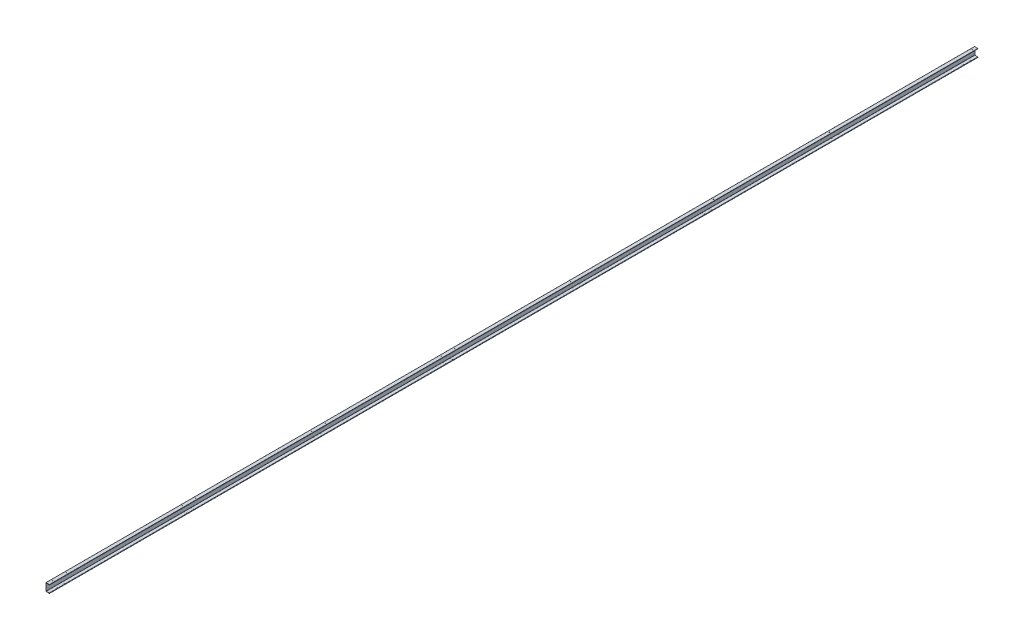
from build123d import *

# Parameters (mm, degrees)
BOSS_EXTRUDE1_DEPTH = 12000
FILLET1_R           = 3
FILLET2_R           = 1
FILLET3_R           = 1
CUT_EXTRUDE2_REACH  = 12002.501
SKETCH2_R           = 3
SKETCH5_R           = 3
CUT_EXTRUDE4_DEPTH  = 10


with BuildPart() as part:
    # Sketch1 → Boss-Extrude1 (new body)
    with BuildSketch(Plane.XY):
        Polygon((0, 50), (0, -50), (45, -50), (45, -44.9), (3, -44.9), (3, 44.9), (45, 44.9), (45, 50), align=None)
    extrude(amount=BOSS_EXTRUDE1_DEPTH)

    # Fillet1
    fillet1_edges = [part.edges().sort_by_distance(p)[0] for p in [
        (45, -44.9, 6000),
        (45, 44.9, 6000),
    ]]
    fillet(fillet1_edges, radius=FILLET1_R)

    # Fillet2
    fillet2_edges = [part.edges().sort_by_distance(p)[0] for p in [
        (45, -50, 6000),
        (0, -50, 6000),
        (0, 50, 6000),
        (45, 50, 6000),
    ]]
    fillet(fillet2_edges, radius=FILLET2_R)

    # Fillet3
    fillet3_edges = [part.edges().sort_by_distance(p)[0] for p in [
        (3, -44.9, 6000),
        (3, 44.9, 6000),
    ]]
    fillet(fillet3_edges, radius=FILLET3_R)

    # Sketch2 → Cut-Extrude2 (cut, up to next)
    with BuildSketch(Plane(origin=(0, 50, 0), x_dir=(1, 0, 0), z_dir=(0, 1, 0)), mode=Mode.PRIVATE) as cut_extrude2_sk1:
        with Locations(Location((22.5, -50, 0), (0, 0, 270))):
            Circle(SKETCH2_R)
    cut_extrude2_tool1 = extrude(cut_extrude2_sk1.sketch, amount=-CUT_EXTRUDE2_REACH, mode=Mode.PRIVATE) & part.part
    # Sketch2 → Cut-Extrude2 (cut, up to next)
    with BuildSketch(Plane(origin=(0, 50, 0), x_dir=(1, 0, 0), z_dir=(0, 1, 0)), mode=Mode.PRIVATE) as cut_extrude2_sk2:
        with Locations(Location((22.5, -223, 0), (0, 0, 270))):
            Circle(SKETCH2_R)
    cut_extrude2_tool2 = extrude(cut_extrude2_sk2.sketch, amount=-CUT_EXTRUDE2_REACH, mode=Mode.PRIVATE) & part.part
    # Sketch2 → Cut-Extrude2 (cut, up to next)
    with BuildSketch(Plane(origin=(0, 50, 0), x_dir=(1, 0, 0), z_dir=(0, 1, 0)), mode=Mode.PRIVATE) as cut_extrude2_sk3:
        with Locations(Location((22.5, -1723, 0), (0, 0, 270))):
            Circle(SKETCH2_R)
    cut_extrude2_tool3 = extrude(cut_extrude2_sk3.sketch, amount=-CUT_EXTRUDE2_REACH, mode=Mode.PRIVATE) & part.part
    # Sketch2 → Cut-Extrude2 (cut, up to next)
    with BuildSketch(Plane(origin=(0, 50, 0), x_dir=(1, 0, 0), z_dir=(0, 1, 0)), mode=Mode.PRIVATE) as cut_extrude2_sk4:
        with Locations(Location((22.5, -1896, 0), (0, 0, 270))):
            Circle(SKETCH2_R)
    cut_extrude2_tool4 = extrude(cut_extrude2_sk4.sketch, amount=-CUT_EXTRUDE2_REACH, mode=Mode.PRIVATE) & part.part
    # Sketch2 → Cut-Extrude2 (cut, up to next)
    with BuildSketch(Plane(origin=(0, 50, 0), x_dir=(1, 0, 0), z_dir=(0, 1, 0)), mode=Mode.PRIVATE) as cut_extrude2_sk5:
        with Locations(Location((22.5, -3396, 0), (0, 0, 270))):
            Circle(SKETCH2_R)
    cut_extrude2_tool5 = extrude(cut_extrude2_sk5.sketch, amount=-CUT_EXTRUDE2_REACH, mode=Mode.PRIVATE) & part.part
    # Sketch2 → Cut-Extrude2 (cut, up to next)
    with BuildSketch(Plane(origin=(0, 50, 0), x_dir=(1, 0, 0), z_dir=(0, 1, 0)), mode=Mode.PRIVATE) as cut_extrude2_sk6:
        with Locations(Location((22.5, -3569, 0), (0, 0, 270))):
            Circle(SKETCH2_R)
    cut_extrude2_tool6 = extrude(cut_extrude2_sk6.sketch, amount=-CUT_EXTRUDE2_REACH, mode=Mode.PRIVATE) & part.part
    # Sketch2 → Cut-Extrude2 (cut, up to next)
    with BuildSketch(Plane(origin=(0, 50, 0), x_dir=(1, 0, 0), z_dir=(0, 1, 0)), mode=Mode.PRIVATE) as cut_extrude2_sk7:
        with Locations(Location((22.5, -5069, 0), (0, 0, 270))):
            Circle(SKETCH2_R)
    cut_extrude2_tool7 = extrude(cut_extrude2_sk7.sketch, amount=-CUT_EXTRUDE2_REACH, mode=Mode.PRIVATE) & part.part
    # Sketch2 → Cut-Extrude2 (cut, up to next)
    with BuildSketch(Plane(origin=(0, 50, 0), x_dir=(1, 0, 0), z_dir=(0, 1, 0)), mode=Mode.PRIVATE) as cut_extrude2_sk8:
        with Locations(Location((22.5, -5242, 0), (0, 0, 270))):
            Circle(SKETCH2_R)
    cut_extrude2_tool8 = extrude(cut_extrude2_sk8.sketch, amount=-CUT_EXTRUDE2_REACH, mode=Mode.PRIVATE) & part.part
    # Sketch2 → Cut-Extrude2 (cut, up to next)
    with BuildSketch(Plane(origin=(0, 50, 0), x_dir=(1, 0, 0), z_dir=(0, 1, 0)), mode=Mode.PRIVATE) as cut_extrude2_sk9:
        with Locations(Location((22.5, -6742, 0), (0, 0, 270))):
            Circle(SKETCH2_R)
    cut_extrude2_tool9 = extrude(cut_extrude2_sk9.sketch, amount=-CUT_EXTRUDE2_REACH, mode=Mode.PRIVATE) & part.part
    # Sketch2 → Cut-Extrude2 (cut, up to next)
    with BuildSketch(Plane(origin=(0, 50, 0), x_dir=(1, 0, 0), z_dir=(0, 1, 0)), mode=Mode.PRIVATE) as cut_extrude2_sk10:
        with Locations(Location((22.5, -6915, 0), (0, 0, 270))):
            Circle(SKETCH2_R)
    cut_extrude2_tool10 = extrude(cut_extrude2_sk10.sketch, amount=-CUT_EXTRUDE2_REACH, mode=Mode.PRIVATE) & part.part
    # Sketch2 → Cut-Extrude2 (cut, up to next)
    with BuildSketch(Plane(origin=(0, 50, 0), x_dir=(1, 0, 0), z_dir=(0, 1, 0)), mode=Mode.PRIVATE) as cut_extrude2_sk11:
        with Locations(Location((22.5, -8415, 0), (0, 0, 270))):
            Circle(SKETCH2_R)
    cut_extrude2_tool11 = extrude(cut_extrude2_sk11.sketch, amount=-CUT_EXTRUDE2_REACH, mode=Mode.PRIVATE) & part.part
    # Sketch2 → Cut-Extrude2 (cut, up to next)
    with BuildSketch(Plane(origin=(0, 50, 0), x_dir=(1, 0, 0), z_dir=(0, 1, 0)), mode=Mode.PRIVATE) as cut_extrude2_sk12:
        with Locations(Location((22.5, -8588, 0), (0, 0, 270))):
            Circle(SKETCH2_R)
    cut_extrude2_tool12 = extrude(cut_extrude2_sk12.sketch, amount=-CUT_EXTRUDE2_REACH, mode=Mode.PRIVATE) & part.part
    # Sketch2 → Cut-Extrude2 (cut, up to next)
    with BuildSketch(Plane(origin=(0, 50, 0), x_dir=(1, 0, 0), z_dir=(0, 1, 0)), mode=Mode.PRIVATE) as cut_extrude2_sk13:
        with Locations(Location((22.5, -10088, 0), (0, 0, 270))):
            Circle(SKETCH2_R)
    cut_extrude2_tool13 = extrude(cut_extrude2_sk13.sketch, amount=-CUT_EXTRUDE2_REACH, mode=Mode.PRIVATE) & part.part
    # Sketch2 → Cut-Extrude2 (cut, up to next)
    with BuildSketch(Plane(origin=(0, 50, 0), x_dir=(1, 0, 0), z_dir=(0, 1, 0)), mode=Mode.PRIVATE) as cut_extrude2_sk14:
        with Locations(Location((22.5, -10261, 0), (0, 0, 270))):
            Circle(SKETCH2_R)
    cut_extrude2_tool14 = extrude(cut_extrude2_sk14.sketch, amount=-CUT_EXTRUDE2_REACH, mode=Mode.PRIVATE) & part.part
    # Sketch2 → Cut-Extrude2 (cut, up to next)
    with BuildSketch(Plane(origin=(0, 50, 0), x_dir=(1, 0, 0), z_dir=(0, 1, 0)), mode=Mode.PRIVATE) as cut_extrude2_sk15:
        with Locations(Location((22.5, -11761, 0), (0, 0, 270))):
            Circle(SKETCH2_R)
    cut_extrude2_tool15 = extrude(cut_extrude2_sk15.sketch, amount=-CUT_EXTRUDE2_REACH, mode=Mode.PRIVATE) & part.part
    # Sketch2 → Cut-Extrude2 (cut, up to next)
    with BuildSketch(Plane(origin=(0, 50, 0), x_dir=(1, 0, 0), z_dir=(0, 1, 0)), mode=Mode.PRIVATE) as cut_extrude2_sk16:
        with Locations(Location((22.5, -11934, 0), (0, 0, 270))):
            Circle(SKETCH2_R)
    cut_extrude2_tool16 = extrude(cut_extrude2_sk16.sketch, amount=-CUT_EXTRUDE2_REACH, mode=Mode.PRIVATE) & part.part
    add(cut_extrude2_tool1.solids().sort_by_distance((22.5, 50, 50))[0], mode=Mode.SUBTRACT)
    add(cut_extrude2_tool2.solids().sort_by_distance((22.5, 50, 223))[0], mode=Mode.SUBTRACT)
    add(cut_extrude2_tool3.solids().sort_by_distance((22.5, 50, 1723))[0], mode=Mode.SUBTRACT)
    add(cut_extrude2_tool4.solids().sort_by_distance((22.5, 50, 1896))[0], mode=Mode.SUBTRACT)
    add(cut_extrude2_tool5.solids().sort_by_distance((22.5, 50, 3396))[0], mode=Mode.SUBTRACT)
    add(cut_extrude2_tool6.solids().sort_by_distance((22.5, 50, 3569))[0], mode=Mode.SUBTRACT)
    add(cut_extrude2_tool7.solids().sort_by_distance((22.5, 50, 5069))[0], mode=Mode.SUBTRACT)
    add(cut_extrude2_tool8.solids().sort_by_distance((22.5, 50, 5242))[0], mode=Mode.SUBTRACT)
    add(cut_extrude2_tool9.solids().sort_by_distance((22.5, 50, 6742))[0], mode=Mode.SUBTRACT)
    add(cut_extrude2_tool10.solids().sort_by_distance((22.5, 50, 6915))[0], mode=Mode.SUBTRACT)
    add(cut_extrude2_tool11.solids().sort_by_distance((22.5, 50, 8415))[0], mode=Mode.SUBTRACT)
    add(cut_extrude2_tool12.solids().sort_by_distance((22.5, 50, 8588))[0], mode=Mode.SUBTRACT)
    add(cut_extrude2_tool13.solids().sort_by_distance((22.5, 50, 10088))[0], mode=Mode.SUBTRACT)
    add(cut_extrude2_tool14.solids().sort_by_distance((22.5, 50, 10261))[0], mode=Mode.SUBTRACT)
    add(cut_extrude2_tool15.solids().sort_by_distance((22.5, 50, 11761))[0], mode=Mode.SUBTRACT)
    add(cut_extrude2_tool16.solids().sort_by_distance((22.5, 50, 11934))[0], mode=Mode.SUBTRACT)

    # Sketch5 → Cut-Extrude4 (cut)
    with BuildSketch(Plane.XZ.offset(50)):
        with Locations(Location((7.5, 10219.498787975, 0), (0, 0, 270))):
            Circle(SKETCH5_R)
        with Locations(Location((37.5, 10219.498787975, 0), (0, 0, 270))):
            Circle(SKETCH5_R)
        with Locations(Location((37.5, 10129.498787975, 0), (0, 0, 270))):
            Circle(SKETCH5_R)
        with Locations(Location((7.5, 10129.498787975, 0), (0, 0, 270))):
            Circle(SKETCH5_R)
        with Locations(Location((7.5, 8546.498787975, 0), (0, 0, 270))):
            Circle(SKETCH5_R)
        with Locations(Location((37.5, 8546.498787975, 0), (0, 0, 270))):
            Circle(SKETCH5_R)
        with Locations(Location((37.5, 8456.498787975, 0), (0, 0, 270))):
            Circle(SKETCH5_R)
        with Locations(Location((7.5, 8456.498787975, 0), (0, 0, 270))):
            Circle(SKETCH5_R)
        with Locations(Location((7.5, 6873.498787975, 0), (0, 0, 270))):
            Circle(SKETCH5_R)
        with Locations(Location((37.5, 6873.498787975, 0), (0, 0, 270))):
            Circle(SKETCH5_R)
        with Locations(Location((37.5, 6783.498787975, 0), (0, 0, 270))):
            Circle(SKETCH5_R)
        with Locations(Location((7.5, 6783.498787975, 0), (0, 0, 270))):
            Circle(SKETCH5_R)
        with Locations(Location((7.5, 5200.498787975, 0), (0, 0, 270))):
            Circle(SKETCH5_R)
        with Locations(Location((37.5, 5200.498787975, 0), (0, 0, 270))):
            Circle(SKETCH5_R)
        with Locations(Location((37.5, 5110.498787975, 0), (0, 0, 270))):
            Circle(SKETCH5_R)
        with Locations(Location((7.5, 5110.498787975, 0), (0, 0, 270))):
            Circle(SKETCH5_R)
        with Locations(Location((7.5, 3527.498787975, 0), (0, 0, 270))):
            Circle(SKETCH5_R)
        with Locations(Location((37.5, 3527.498787975, 0), (0, 0, 270))):
            Circle(SKETCH5_R)
        with Locations(Location((37.5, 3437.498787975, 0), (0, 0, 270))):
            Circle(SKETCH5_R)
        with Locations(Location((7.5, 3437.498787975, 0), (0, 0, 270))):
            Circle(SKETCH5_R)
        with Locations(Location((7.5, 1854.498787975, 0), (0, 0, 270))):
            Circle(SKETCH5_R)
        with Locations(Location((37.5, 1854.498787975, 0), (0, 0, 270))):
            Circle(SKETCH5_R)
        with Locations(Location((37.5, 1764.498787975, 0), (0, 0, 270))):
            Circle(SKETCH5_R)
        with Locations(Location((7.5, 1764.498787975, 0), (0, 0, 270))):
            Circle(SKETCH5_R)
        with Locations(Location((7.5, 181.498787975, 0), (0, 0, 270))):
            Circle(SKETCH5_R)
        with Locations(Location((37.5, 181.498787975, 0), (0, 0, 270))):
            Circle(SKETCH5_R)
        with Locations(Location((37.5, 91.498787975, 0), (0, 0, 270))):
            Circle(SKETCH5_R)
        with Locations(Location((7.5, 91.498787975, 0), (0, 0, 270))):
            Circle(SKETCH5_R)
        with Locations(Location((7.5, 11892.498787975, 0), (0, 0, 270))):
            Circle(SKETCH5_R)
        with Locations(Location((37.5, 11892.498787975, 0), (0, 0, 270))):
            Circle(SKETCH5_R)
        with Locations(Location((37.5, 11802.498787975, 0), (0, 0, 270))):
            Circle(SKETCH5_R)
        with Locations(Location((7.5, 11802.498787975, 0), (0, 0, 270))):
            Circle(SKETCH5_R)
    extrude(amount=-CUT_EXTRUDE4_DEPTH, mode=Mode.SUBTRACT)


solid = part.part
